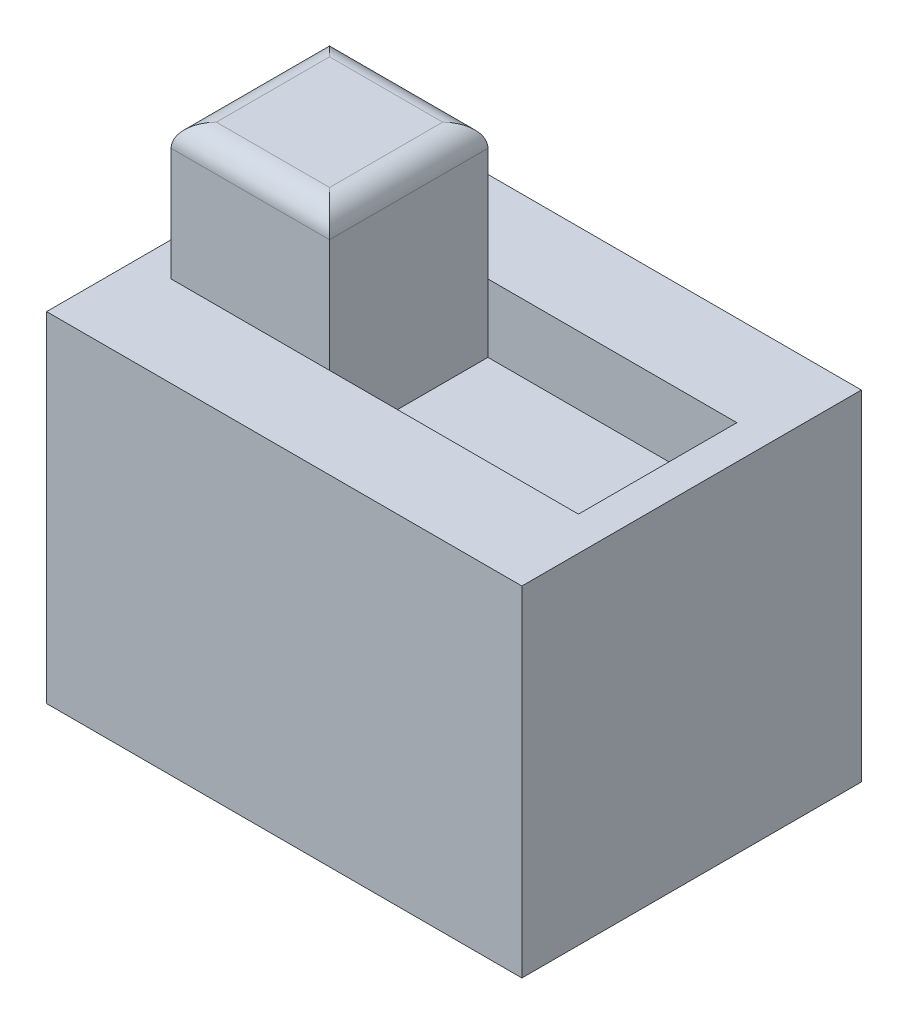
from build123d import *

# Parameters (mm, degrees)
SKETCH1_W           = 21
SKETCH1_H           = 15
BOSS_EXTRUDE1_DEPTH = 15
SKETCH3_W           = 18
SKETCH3_H           = 7
CUT_EXTRUDE1_DEPTH  = 3
SKETCH4_W           = 7
SKETCH4_H           = 7
BOSS_EXTRUDE3_DEPTH = 9
FILLET2_R           = 1


with BuildPart() as part:
    # Sketch1 → Boss-Extrude1 (new body)
    with BuildSketch(Plane(origin=(0, 0, 0), x_dir=(1, 0, 0), z_dir=(0, 1, 0))):
        Rectangle(SKETCH1_W, SKETCH1_H)
    extrude(amount=BOSS_EXTRUDE1_DEPTH)

    # Sketch3 → Cut-Extrude1 (cut)
    with BuildSketch(Plane(origin=(0, 15, 0), x_dir=(1, 0, 0), z_dir=(0, 1, 0))):
        Rectangle(SKETCH3_W, SKETCH3_H)
    extrude(amount=-CUT_EXTRUDE1_DEPTH, mode=Mode.SUBTRACT)

    # Sketch4 → Boss-Extrude3 (add)
    with BuildSketch(Plane(origin=(0, 12, 0), x_dir=(1, 0, 0), z_dir=(0, 1, 0))):
        with Locations((-5.5, 0)):
            Rectangle(SKETCH4_W, SKETCH4_H)
    extrude(amount=BOSS_EXTRUDE3_DEPTH)

    # Fillet2
    fillet2_edges = [part.edges().sort_by_distance(p)[0] for p in [
        (-9, 21, 0),
        (-5.5, 21, 3.5),
        (-2, 21, 0),
        (-5.5, 21, -3.5),
    ]]
    fillet(fillet2_edges, radius=FILLET2_R)


solid = part.part
